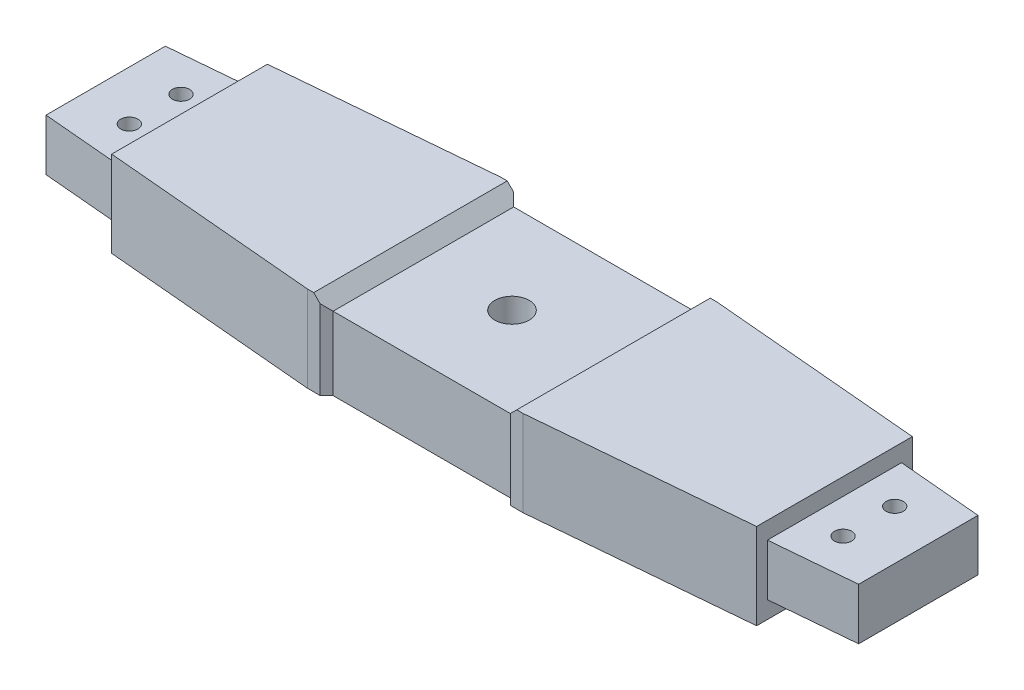
from build123d import *

# Parameters (mm, degrees)
SKETCH1_R                = 4
BOSS_EXTRUDE1_DEPTH      = 12
BOSS_EXTRUDE2_DEPTH      = 4
BOSS_EXTRUDE2_DEPTH_BACK = 16
SKETCH2_R                = 4
CUT_EXTRUDE1_DEPTH       = 107.329676008
CUT_EXTRUDE1_DEPTH_BACK  = 107.329676008
SKETCH6_R                = 2.05
CUT_EXTRUDE3_DEPTH       = 6.5
SKETCH7_R                = 2
CUT_EXTRUDE4_DEPTH       = 99.930531182
CUT_EXTRUDE5_DEPTH       = 100.65565714
CUT_EXTRUDE5_DEPTH_BACK  = 100.65565714
CUT_EXTRUDE6_DEPTH       = 99.930531182


with BuildPart() as part:
    # Sketch1 → Boss-Extrude1 (new body)
    with BuildSketch(Plane(origin=(0, 0, 0), x_dir=(1, 0, 0), z_dir=(0, 1, 0))):
        Polygon((25, 20), (-25, 20), (-95, 13.834935185), (-95, -13.834935185), (-25, -20), (25, -20), (95, -13.834935185), (95, 13.834935185), align=None)
        with Locations(Location((0, 0, 0), (0, 0, 270))):
            Circle(SKETCH1_R, mode=Mode.SUBTRACT)
    extrude(amount=BOSS_EXTRUDE1_DEPTH)

    # Sketch2 → Boss-Extrude2 (add, two sides: drawn at the far end of the back side and taken through both)
    # profile 1 of 3: a face of its own
    with BuildSketch(Plane(origin=(0, 12, 0), x_dir=(1, 0, 0), z_dir=(0, 1, 0)).offset(-BOSS_EXTRUDE2_DEPTH_BACK)):
        Polygon((-25, 20), (-75, 15.596382275), (-75, -15.596382275), (-25, -20), (25, -20), (75, -15.596382275), (75, 15.596382275), (25, 20), align=None)
        with Locations(Location((0, 0, 0), (0, 0, 270))):
            Circle(SKETCH2_R, mode=Mode.SUBTRACT)
    # profile 2 of 3: a face of its own
    with BuildSketch(Plane(origin=(0, 12, 0), x_dir=(1, 0, 0), z_dir=(0, 1, 0)).offset(-BOSS_EXTRUDE2_DEPTH_BACK)):
        Polygon((-25, -20), (-75, -15.596382275), (-75, -18.10605947), (-25.109877781, -22.5), (25.109877781, -22.5), (75, -18.10605947), (75, -15.596382275), (25, -20), align=None)
    # profile 3 of 3: a face of its own
    with BuildSketch(Plane(origin=(0, 12, 0), x_dir=(1, 0, 0), z_dir=(0, 1, 0)).offset(-BOSS_EXTRUDE2_DEPTH_BACK)):
        Polygon((-25.109877781, 22.5), (-75, 18.10605947), (-75, 15.596382275), (-25, 20), (25, 20), (75, 15.596382275), (75, 18.10605947), (25.109877781, 22.5), align=None)
    extrude(amount=BOSS_EXTRUDE2_DEPTH + BOSS_EXTRUDE2_DEPTH_BACK)

    # Sketch3 → Cut-Extrude1 (cut, two sides: drawn at the far end of the back side and taken through both)
    with BuildSketch(Plane.XY.offset(22.5).offset(-CUT_EXTRUDE1_DEPTH_BACK)):
        Polygon((23.609877781, 16), (-23.609877781, 16), (-20.609877781, 13), (20.609877781, 13), align=None)
    extrude(amount=CUT_EXTRUDE1_DEPTH + CUT_EXTRUDE1_DEPTH_BACK, mode=Mode.SUBTRACT)

    # Sketch6 → Cut-Extrude3 (cut)
    with BuildSketch(Plane(origin=(0, 0, -22.5), x_dir=(-1, 0, 0), z_dir=(0, 0, -1))):
        with Locations((-10, 4.5)):
            Circle(SKETCH6_R)
        with Locations((10, 4.5)):
            Circle(SKETCH6_R)
    extrude(amount=-CUT_EXTRUDE3_DEPTH, mode=Mode.SUBTRACT)

    # Sketch7 → Cut-Extrude4 (cut, through all)
    with BuildSketch(Plane.XZ):
        with Locations(Location((-83, -6, 0), (0, 0, 270))):
            Circle(SKETCH7_R)
        with Locations(Location((-83, 6, 0), (0, 0, 270))):
            Circle(SKETCH7_R)
        with Locations(Location((83, 6, 0), (0, 0, 90))):
            Circle(SKETCH7_R)
        with Locations(Location((83, -6, 0), (0, 0, 90))):
            Circle(SKETCH7_R)
    extrude(amount=-CUT_EXTRUDE4_DEPTH, mode=Mode.SUBTRACT)

    # Sketch8 → Cut-Extrude5 (cut, two sides: drawn at the far end of the back side and taken through both)
    with BuildSketch(Plane.XZ.offset(4).offset(-CUT_EXTRUDE5_DEPTH_BACK)):
        Polygon((-22.109877781, -22.5), (-20.609877781, -21), (20.609877781, -21), (22.109877781, -22.5), align=None)
        Polygon((-22.109877781, 22.5), (22.109877781, 22.5), (20.609877781, 21), (-20.609877781, 21), align=None)
    extrude(amount=CUT_EXTRUDE5_DEPTH + CUT_EXTRUDE5_DEPTH_BACK, mode=Mode.SUBTRACT)

    # Sketch9 → Cut-Extrude6 (cut, through all)
    with BuildSketch(Plane(origin=(0, 12, 0), x_dir=(1, 0, 0), z_dir=(0, 1, 0))):
        Polygon((-94.5, 13.878971362), (-94.5, -13.878971362), (-95, -13.834935185), (-95, 13.834935185), align=None)
        Polygon((94.5, 13.878971362), (94.5, -13.878971362), (95, -13.834935185), (95, 13.834935185), align=None)
    extrude(amount=-CUT_EXTRUDE6_DEPTH, mode=Mode.SUBTRACT)


solid = part.part
